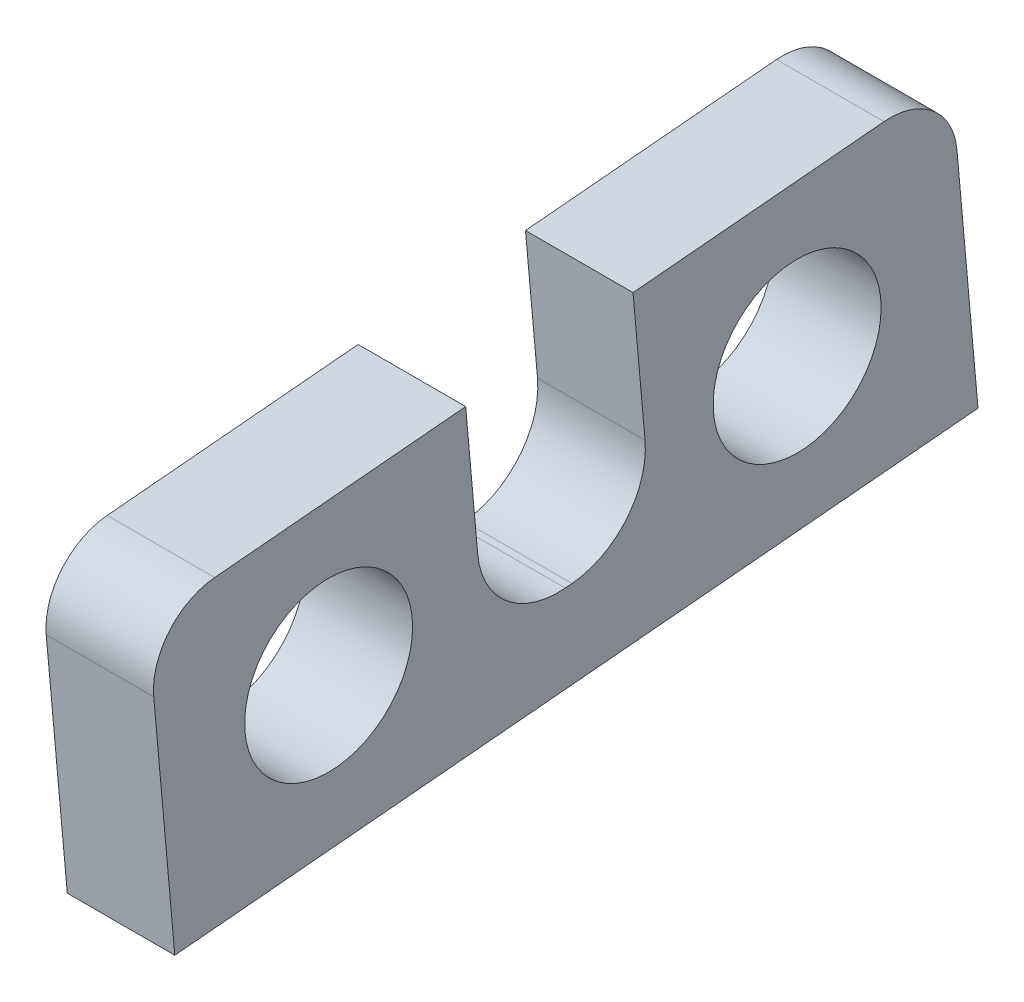
from build123d import *

# Parameters (mm, degrees)
SKETCH_1_R      = 1.25
EXTRUDE_1_DEPTH = 1.6


with BuildPart() as part:
    # Эскиз1 → Бобышка-Вытянуть1 (new body)
    with BuildSketch(Plane(origin=(0, 0, 0), x_dir=(0, 0, -1), z_dir=(1, 0, 0))):
        with BuildLine():
            Line((2.714158993, 32.8544628), (3.027276679, 29.368497035))
            Line((3.027276679, 29.368497035), (-8.924605944, 28.294950683))
            Line((-8.924605944, 28.294950683), (-9.23772363, 31.780916448))
            ThreePointArc((-9.23772363, 31.780916448), (-9.009264175, 32.511390756), (-8.331195608, 32.866368862))
            Line((-8.331195608, 32.866368862), (-4.596232288, 33.201852097))
            Line((-4.596232288, 33.201852097), (-4.417307896, 31.20987166))
            ThreePointArc((-4.417307896, 31.20987166), (-3.991334168, 30.39618938), (-3.114764999, 30.122038033))
            Line((-3.114764999, 30.122038033), (-3.015165977, 30.130984253))
            ThreePointArc((-3.015165977, 30.130984253), (-2.201483696, 30.55695798), (-1.92733235, 31.43352715))
            Line((-1.92733235, 31.43352715), (-2.106256742, 33.425507587))
            Line((-2.106256742, 33.425507587), (1.628706578, 33.760990822))
            ThreePointArc((1.628706578, 33.760990822), (2.359180886, 33.532531367), (2.714158993, 32.8544628))
        make_face()
        with Locations((-6.635920339, 30.759584164)):
            Circle(SKETCH_1_R, mode=Mode.SUBTRACT)
        with Locations((0.336011191, 31.385819536)):
            Circle(SKETCH_1_R, mode=Mode.SUBTRACT)
    extrude(amount=EXTRUDE_1_DEPTH)


solid = part.part
